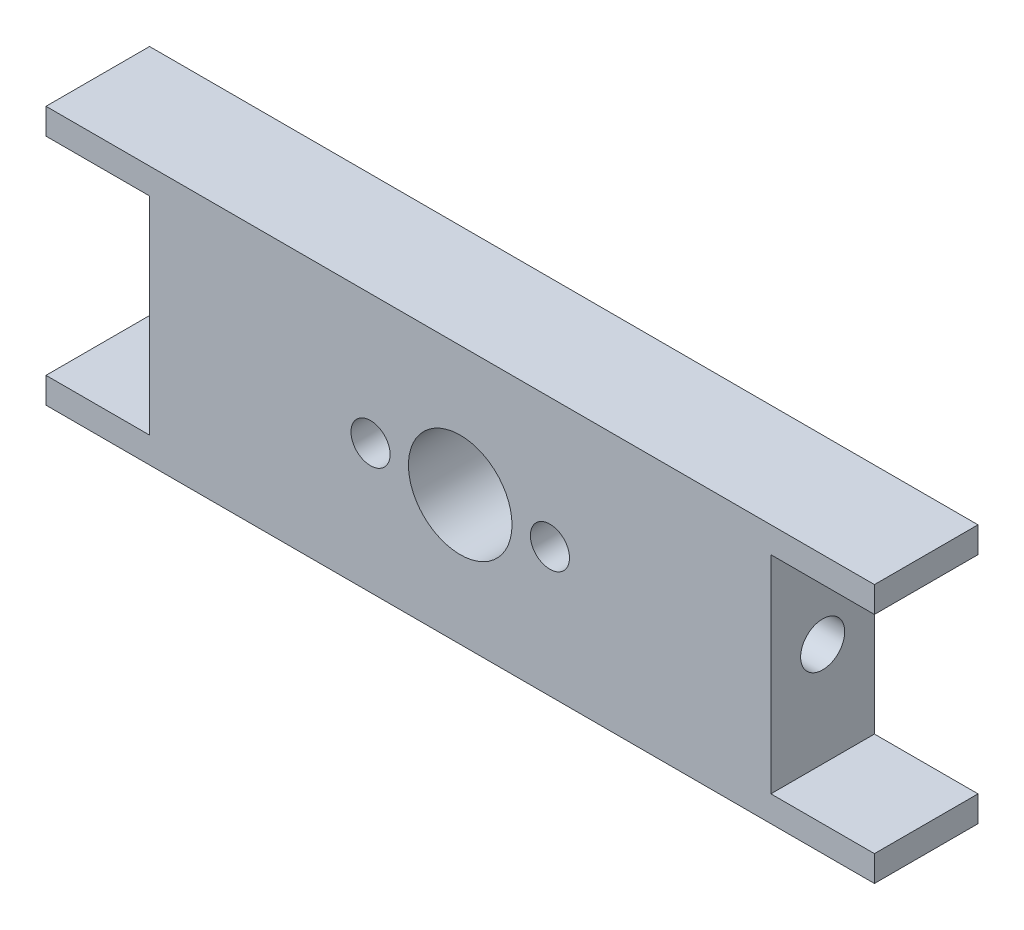
from build123d import *

# Parameters (mm, degrees)
SKETCH1_R                      = 3.175
BOSS_EXTRUDE1_DEPTH            = 6.35
M2_CLEARANCE_HOLE1_D           = 2.4
M2_CLEARANCE_HOLE1_CSINK_D     = 2.45
M2_CLEARANCE_HOLE1_CSINK_ANGLE = 90


with BuildPart() as part:
    # Sketch1 → Boss-Extrude1 (new body)
    with BuildSketch(Plane.XY):
        Polygon((25.4, -6.35), (25.4, -7.9375), (-25.4, -7.9375), (-25.4, -6.35), (-19.05, -6.35), (-19.05, 6.35), (-25.4, 6.35), (-25.4, 7.9375), (25.4, 7.9375), (25.4, 6.35), (19.05, 6.35), (19.05, -6.35), align=None)
        Circle(SKETCH1_R, mode=Mode.SUBTRACT)
    extrude(amount=BOSS_EXTRUDE1_DEPTH)

    # Sketch4 → Tap Drill for #6-32 Tap1 (revolve, cut)
    with BuildSketch(Plane(origin=(19.05, 0, 3.175), x_dir=(0, 0, -1), z_dir=(0, 1, 0))):
        Polygon((0, 0), (0, 7.16269403), (1.35255, 6.35), (1.35255, 0), align=None)
    tap_drill_for_6_32_tap1 = revolve(axis=Axis((25.4, 0, 3.175), (-1, 0, 0)), mode=Mode.SUBTRACT)

    # M2 Clearance Hole1 (through all)
    with Locations(Plane(origin=(0, 0, 0), x_dir=(-1, 0, 0), z_dir=(0, 0, -1))):
        with Locations((-5.5, 0), (5.5, 0)):
            CounterSinkHole(M2_CLEARANCE_HOLE1_D / 2, M2_CLEARANCE_HOLE1_CSINK_D / 2, counter_sink_angle=M2_CLEARANCE_HOLE1_CSINK_ANGLE)

    # Mirror1: Tap Drill for #6-32 Tap1 across plane
    add(tap_drill_for_6_32_tap1.mirror(Plane.ZY), mode=Mode.SUBTRACT)


solid = part.part
